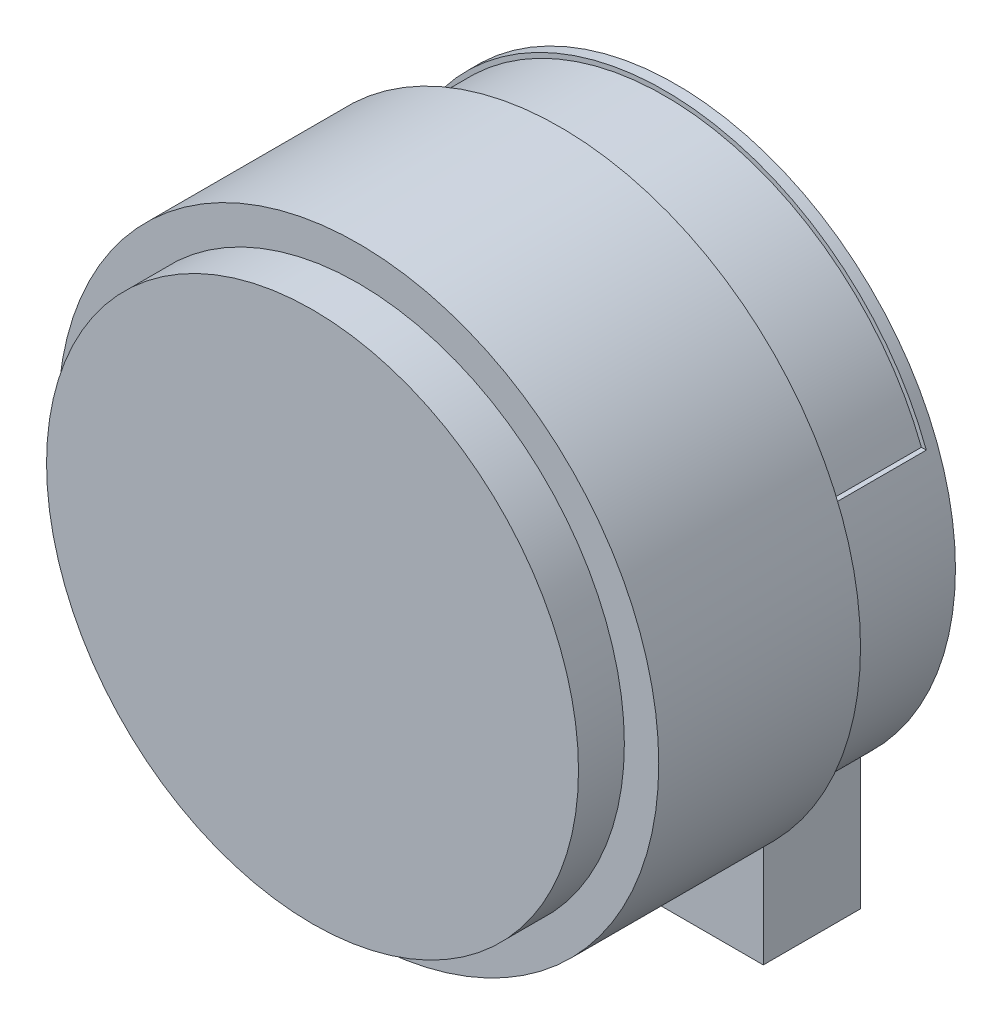
from build123d import *

# Parameters (mm, degrees)
SKETCH_1_R          = 30.5
EXTRUDE_1_DEPTH     = 12.6
SKETCH_2_R          = 32.75
EXTRUDE_2_DEPTH     = 22
SKETCH_3_R          = 29
EXTRUDE_3_DEPTH     = 5
EXTRUDE_START       = -1.1
EXTRUDE_4_DEPTH     = 10.6
SKETCH_5_R          = 1.5
CUT_EXTRUDE_1_DEPTH = 5
SKETCH_6_R          = 27.75
CUT_EXTRUDE_2_DEPTH = 2
CUT_EXTRUDE_START   = -1.2
CUT_EXTRUDE_3_DEPTH = 10.8


with BuildPart() as part:
    # 草图1 → 凸台-拉伸1 (new body)
    with BuildSketch(Plane.XY):
        Circle(SKETCH_1_R)
    extrude(amount=EXTRUDE_1_DEPTH)

    # 草图2 → 凸台-拉伸2 (add)
    with BuildSketch(Plane.XY.offset(12.6)):
        Circle(SKETCH_2_R)
    extrude(amount=EXTRUDE_2_DEPTH)

    # 草图3 → 凸台-拉伸3 (add)
    with BuildSketch(Plane.XY.offset(34.6)):
        Circle(SKETCH_3_R)
    extrude(amount=EXTRUDE_3_DEPTH)

    # 草图4 → 凸台-拉伸4 (add)
    with BuildSketch(Plane(origin=(0, 0, 0), x_dir=(-1, 0, 0), z_dir=(0, 0, -1)).offset(EXTRUDE_START)):
        with BuildLine():
            ThreePointArc((21.25, -21.878928219), (0, -30.5), (-21.25, -21.878928219))
            Line((-21.25, -21.878928219), (-21.25, -36.2))
            Line((-21.25, -36.2), (21.25, -36.2))
            Line((21.25, -36.2), (21.25, -21.878928219))
        make_face()
    extrude(amount=-EXTRUDE_4_DEPTH)

    # 草图5 → 切除-拉伸1 (cut)
    with BuildSketch(Plane.XZ.offset(36.2)):
        with Locations(Location((-18, 6.4, 0), (0, 0, 270))):
            Circle(SKETCH_5_R)
        with Locations(Location((18, 6.4, 0), (0, 0, 90))):
            Circle(SKETCH_5_R)
    extrude(amount=-CUT_EXTRUDE_1_DEPTH, mode=Mode.SUBTRACT)

    # 草图6 → 切除-拉伸2 (cut)
    with BuildSketch(Plane(origin=(0, 0, 0), x_dir=(-1, 0, 0), z_dir=(0, 0, -1))):
        Circle(SKETCH_6_R)
    extrude(amount=-CUT_EXTRUDE_2_DEPTH, mode=Mode.SUBTRACT)

    # 草图7 → 切除-拉伸3 (cut)
    with BuildSketch(Plane(origin=(0, 0, 0), x_dir=(-1, 0, 0), z_dir=(0, 0, -1)).offset(CUT_EXTRUDE_START)):
        with BuildLine():
            ThreePointArc((28.52384967, 10.8), (0, 30.5), (-28.52384967, 10.8))
            Line((-28.52384967, 10.8), (-27.988569095, 10.8))
            ThreePointArc((-27.988569095, 10.8), (0, 30), (27.988569095, 10.8))
            Line((27.988569095, 10.8), (28.52384967, 10.8))
        make_face()
    extrude(amount=-CUT_EXTRUDE_3_DEPTH, mode=Mode.SUBTRACT)


solid = part.part
